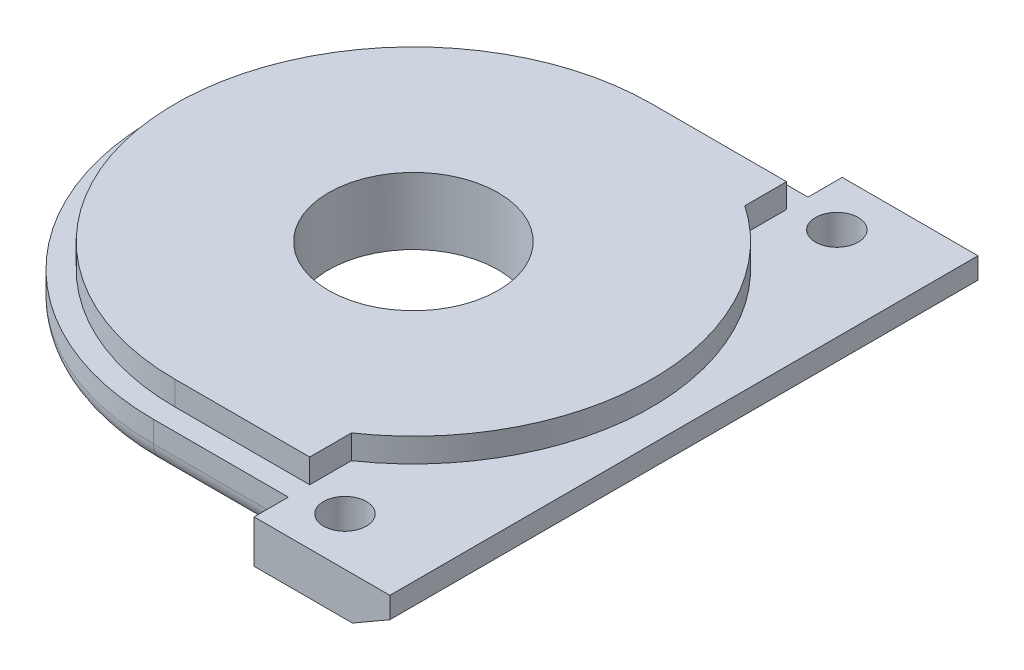
from build123d import *

# Parameters (mm, degrees)
BOSS_EXTRUDE1_DEPTH = 4
BOSS_EXTRUDE2_DEPTH = 2.25
SKETCH3_R           = 7.925
CUT_EXTRUDE1_DEPTH  = 9.25
SKETCH4_R           = 2
CUT_EXTRUDE2_DEPTH  = 9.25
CUT_EXTRUDE3_DEPTH  = 3
FILLET1_R           = 2.36
CHAMFER1_SIZE       = 3.5
CHAMFER1_SIZE2      = 2.020725942
BOSS_EXTRUDE3_DEPTH = 4
FILLET2_R           = 2


with BuildPart() as part:
    # Sketch1 → Boss-Extrude1 (new body)
    with BuildSketch(Plane(origin=(0, 0, 0), x_dir=(1, 0, 0), z_dir=(0, 1, 0))):
        with BuildLine():
            Line((-13.29118379, 20.889836125), (-0.68999579, 20.889836125))
            Line((-0.68999579, 20.889836125), (-0.68999579, 24.09210312))
            Line((-0.68999579, 24.09210312), (-0.68999579, 26.09210312))
            Line((-0.68999579, 26.09210312), (12.01000421, 26.09210312))
            Line((12.01000421, 26.09210312), (12.01000421, 24.09210312))
            Line((12.01000421, 24.09210312), (12.01000421, -26.90789688))
            Line((12.01000421, -26.90789688), (12.01000421, -28.90789688))
            Line((12.01000421, -28.90789688), (-0.68999579, -28.90789688))
            Line((-0.68999579, -28.90789688), (-0.68999579, -26.90789688))
            Line((-0.68999579, -26.90789688), (-0.68999579, -23.705629885))
            Line((-0.68999579, -23.705629885), (-13.29118379, -23.705629885))
            ThreePointArc((-13.29118379, -23.705629885), (-35.588916795, -1.40789688), (-13.29118379, 20.889836125))
        make_face()
    extrude(amount=BOSS_EXTRUDE1_DEPTH)

    # Sketch2 → Boss-Extrude2 (add)
    with BuildSketch(Plane(origin=(0, 4, 0), x_dir=(1, 0, 0), z_dir=(0, 1, 0))):
        with BuildLine():
            Line((-0.68999579, 20.889836125), (-0.68999579, 16.987726462))
            ThreePointArc((-0.68999579, 16.987726462), (9.006549215, -1.40789688), (-0.68999579, -19.803520222))
            Line((-0.68999579, -19.803520222), (-0.68999579, -23.705629885))
            Line((-0.68999579, -23.705629885), (-13.29118379, -23.705629885))
            ThreePointArc((-13.29118379, -23.705629885), (-35.588916795, -1.40789688), (-13.29118379, 20.889836125))
            Line((-13.29118379, 20.889836125), (-0.68999579, 20.889836125))
        make_face()
    extrude(amount=BOSS_EXTRUDE2_DEPTH)

    # Sketch3 → Cut-Extrude1 (cut)
    with BuildSketch(Plane.XZ):
        with Locations((-13.29118379, 1.40789688)):
            Circle(SKETCH3_R)
    extrude(amount=-CUT_EXTRUDE1_DEPTH, mode=Mode.SUBTRACT)

    # Sketch4 → Cut-Extrude2 (cut)
    with BuildSketch(Plane.XZ):
        with Locations((3.31000421, -21.59210312)):
            Circle(SKETCH4_R)
        with Locations((3.31000421, 24.40789688)):
            Circle(SKETCH4_R)
    extrude(amount=-CUT_EXTRUDE2_DEPTH, mode=Mode.SUBTRACT)

    # Sketch5 → Cut-Extrude3 (cut)
    with BuildSketch(Plane.XZ):
        with BuildLine():
            ThreePointArc((-20.901279021, -7.773174712), (-25.21618379, 1.40789688), (-20.901279021, 10.588968471))
            Line((-20.901279021, 10.588968471), (-24.18129969, 16.27013092))
            ThreePointArc((-24.18129969, 16.27013092), (-31.71618379, 1.40789688), (-24.18129969, -13.454337161))
            Line((-24.18129969, -13.454337161), (-20.901279021, -7.773174712))
        make_face()
        with BuildLine():
            Line((-20.717198075, 18.27013092), (-17.437177406, 12.588968471))
            ThreePointArc((-17.437177406, 12.588968471), (-7.32868379, 11.73524982), (-1.535094942, 3.40789688))
            Line((-1.535094942, 3.40789688), (5.024946397, 3.40789688))
            ThreePointArc((5.024946397, 3.40789688), (-4.07868379, 17.364414944), (-20.717198075, 18.27013092))
        make_face()
        with BuildLine():
            ThreePointArc((-1.535094942, -0.59210312), (-7.32868379, -8.91945606), (-17.437177406, -9.773174712))
            Line((-17.437177406, -9.773174712), (-20.717198075, -15.454337161))
            ThreePointArc((-20.717198075, -15.454337161), (-4.07868379, -14.548621185), (5.024946397, -0.59210312))
            Line((5.024946397, -0.59210312), (-1.535094942, -0.59210312))
        make_face()
    extrude(amount=-CUT_EXTRUDE3_DEPTH, mode=Mode.SUBTRACT)

    # Fillet1
    fillet1_edges = [part.edges().sort_by_distance(p)[0] for p in [
        (5.024946397, 1.5, 3.40789688),
        (-1.535094942, 1.5, 3.40789688),
        (5.024946397, 1.5, -0.59210312),
        (-24.18129969, 1.5, 16.27013092),
        (-20.717198075, 1.5, 18.27013092),
        (-1.535094942, 1.5, -0.59210312),
        (-20.717198075, 1.5, -15.454337161),
        (-20.901279021, 1.5, 10.588968471),
        (-20.901279021, 1.5, -7.773174712),
        (-24.18129969, 1.5, -13.454337161),
        (-17.437177406, 1.5, -9.773174712),
        (-17.437177406, 1.5, 12.588968471),
    ]]
    fillet(fillet1_edges, radius=FILLET1_R)

    # Chamfer1
    chamfer1_edges = [part.edges().sort_by_distance(p)[0] for p in [
        (12.01000421, 0, 1.40789688),
    ]]
    chamfer1_side = [part.faces().sort_by_distance(p)[0] for p in [
        (-3.714999267, 0, 17.994335016),
    ]]
    chamfer(chamfer1_edges, length=CHAMFER1_SIZE, length2=CHAMFER1_SIZE2, reference=chamfer1_side[0])

    # Sketch6 → Boss-Extrude3 (add)
    with BuildSketch(Plane.XZ):
        with BuildLine():
            Line((-0.68999579, -22.889836125), (-13.29118379, -22.889836125))
            ThreePointArc((-13.29118379, -22.889836125), (-37.588916795, 1.40789688), (-13.29118379, 25.705629885))
            Line((-13.29118379, 25.705629885), (-0.68999579, 25.705629885))
            Line((-0.68999579, 25.705629885), (-0.68999579, 23.705629885))
            Line((-0.68999579, 23.705629885), (-13.29118379, 23.705629885))
            ThreePointArc((-13.29118379, 23.705629885), (-35.588916795, 1.40789688), (-13.29118379, -20.889836125))
            Line((-13.29118379, -20.889836125), (-0.68999579, -20.889836125))
            Line((-0.68999579, -20.889836125), (-0.68999579, -22.889836125))
        make_face()
    extrude(amount=-BOSS_EXTRUDE3_DEPTH)

    # Fillet2
    fillet2_edges = [part.edges().sort_by_distance(p)[0] for p in [
        (-6.99058979, 0, 25.705629885),
        (-6.99058979, 0, -22.889836125),
        (-37.588916795, 0, 1.40789688),
    ]]
    fillet(fillet2_edges, radius=FILLET2_R)


solid = part.part
